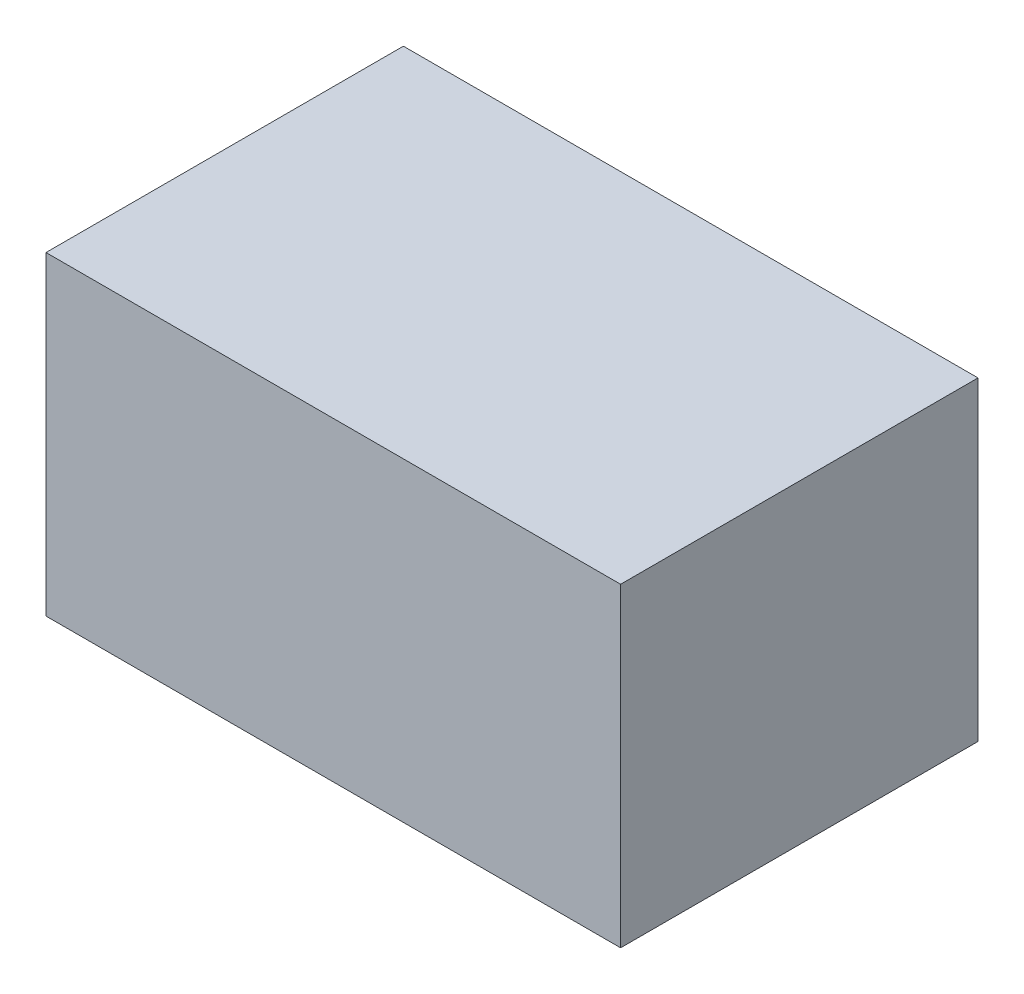
from build123d import *

# Parameters (mm, degrees)
CURVESKETCH_W   = 31.719
CURVESKETCH_H   = 17.381
CURVEBOSS_DEPTH = 19.729


with BuildPart() as part:
    # CurveSketch → CurveBoss (new body)
    with BuildSketch(Plane.XY):
        with Locations((-4.193, 6.827)):
            Rectangle(CURVESKETCH_W, CURVESKETCH_H)
    extrude(amount=-CURVEBOSS_DEPTH)


solid = part.part
